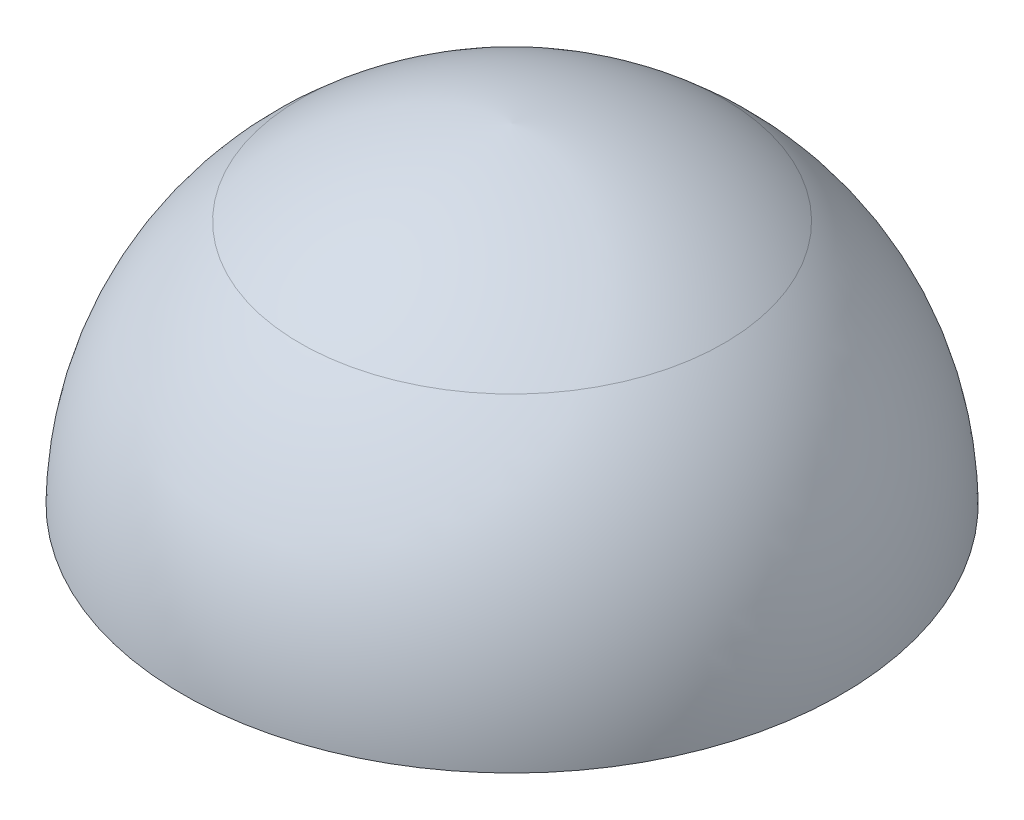
from build123d import *

# Parameters (mm, degrees)
SHELL1_T = -2


with BuildPart() as part:
    # Sketch4 → Revolve1 (revolve)
    with BuildSketch(Plane(origin=(0, 0, 0), x_dir=(0, 0, -1), z_dir=(1, 0, 0)), mode=Mode.PRIVATE) as revolve1_sk:
        with BuildLine():
            Line((0, 0), (-4, 0))
            ThreePointArc((-4, 0), (-3.611507053, 1.643401837), (-2.570397552, 2.972983492))
            ThreePointArc((-2.570397552, 2.972983492), (-1.365508261, 3.687488809), (0, 4))
            Line((0, 4), (0, 0))
        make_face()
    revolve(revolve1_sk.sketch.rotate(Axis((0, 0, 0), (0, 1, 0)), 180), axis=Axis((0, 0, 0), (0, 1, 0)))

    # Shell1
    shell1_openings = [part.faces().sort_by_distance(p)[0] for p in [
        (0, 0, 0),
    ]]
    offset(amount=SHELL1_T, openings=shell1_openings, kind=Kind.INTERSECTION)


solid = part.part
